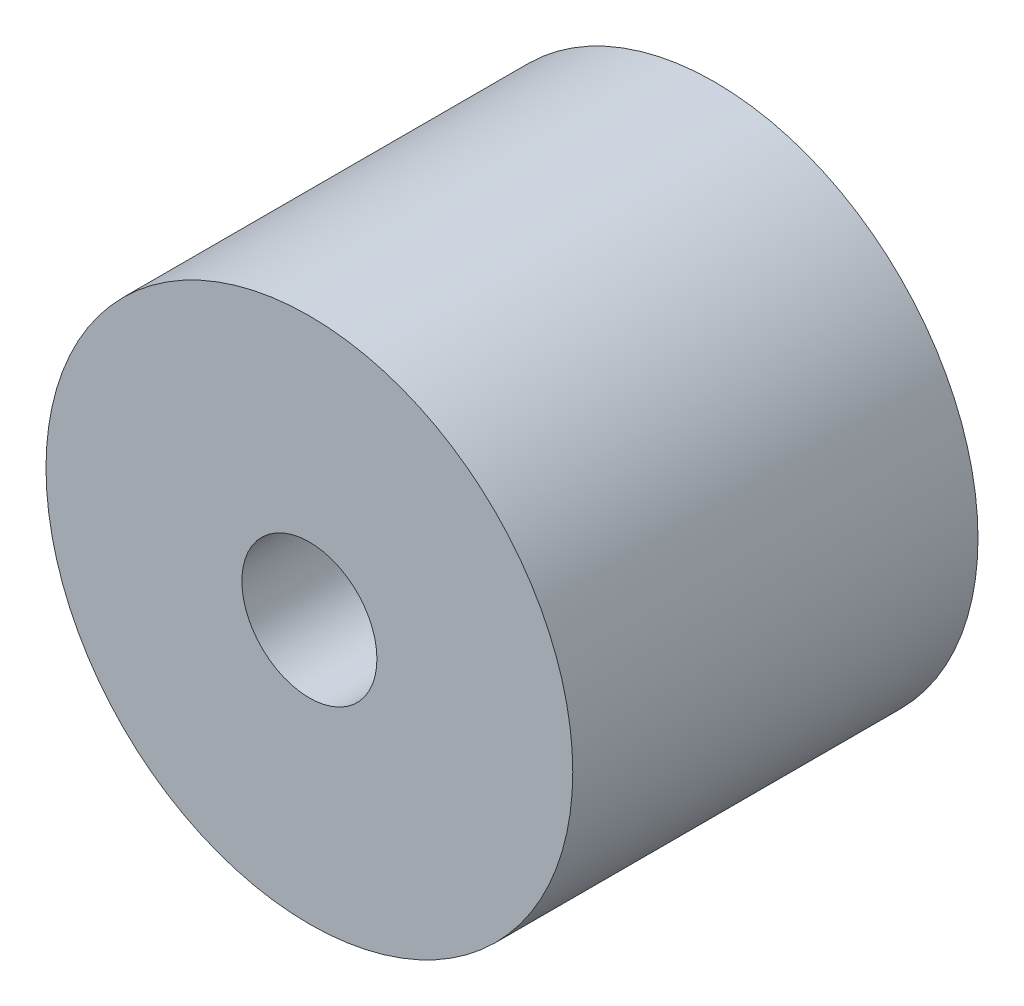
from build123d import *

# Parameters (mm, degrees)
SKETCH1_R           = 19.5
BOSS_EXTRUDE1_DEPTH = 15
SKETCH2_R           = 5
CUT_EXTRUDE1_DEPTH  = 32


with BuildPart() as part:
    # Sketch1 → Boss-Extrude1 (new, symmetric)
    with BuildSketch(Plane.XY):
        Circle(SKETCH1_R)
    extrude(amount=BOSS_EXTRUDE1_DEPTH, both=True)

    # Sketch2 → Cut-Extrude1 (cut)
    with BuildSketch(Plane.XY.offset(15)):
        Circle(SKETCH2_R)
    extrude(amount=-CUT_EXTRUDE1_DEPTH, mode=Mode.SUBTRACT)


solid = part.part
